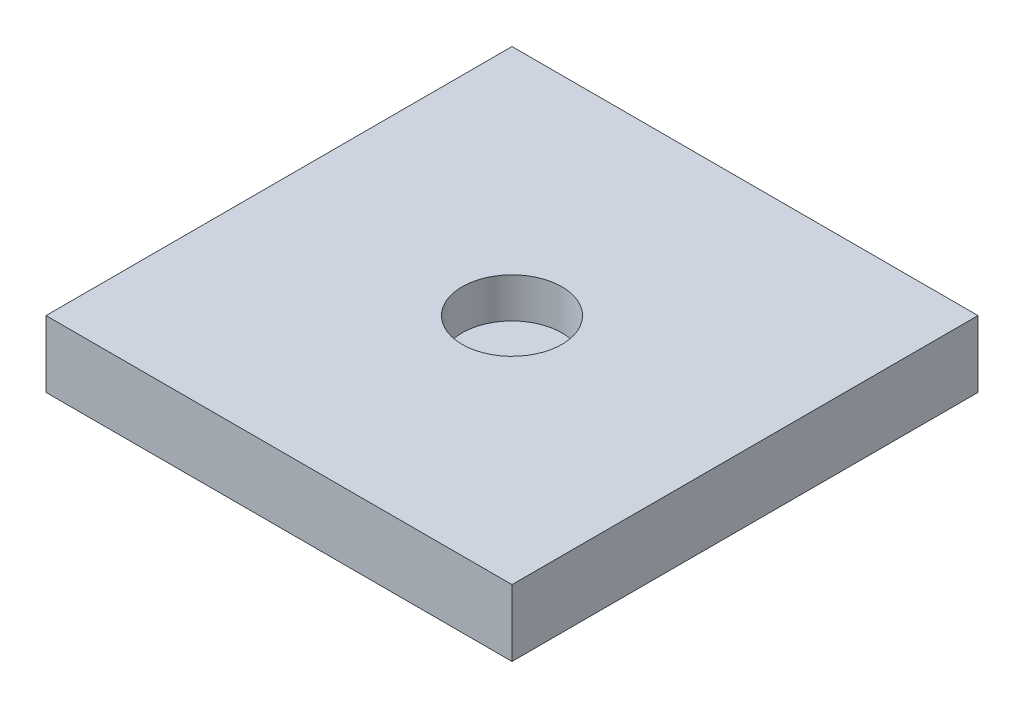
from build123d import *

# Parameters (mm, degrees)
SKETCH_1_W          = 35
SKETCH_1_H          = 35
EXTRUDE_1_DEPTH     = 5
SKETCH_2_R          = 3.75
CUT_EXTRUDE_1_DEPTH = 3


with BuildPart() as part:
    # 草图1 → 凸台-拉伸1 (new body)
    with BuildSketch(Plane(origin=(0, 0, 0), x_dir=(1, 0, 0), z_dir=(0, 1, 0))):
        Rectangle(SKETCH_1_W, SKETCH_1_H)
    extrude(amount=EXTRUDE_1_DEPTH)

    # 草图2 → 切除-拉伸1 (cut)
    with BuildSketch(Plane(origin=(0, 5, 0), x_dir=(1, 0, 0), z_dir=(0, 1, 0))):
        with Locations(Location((0, 0, 0), (0, 0, 270))):
            Circle(SKETCH_2_R)
    extrude(amount=-CUT_EXTRUDE_1_DEPTH, mode=Mode.SUBTRACT)


solid = part.part
